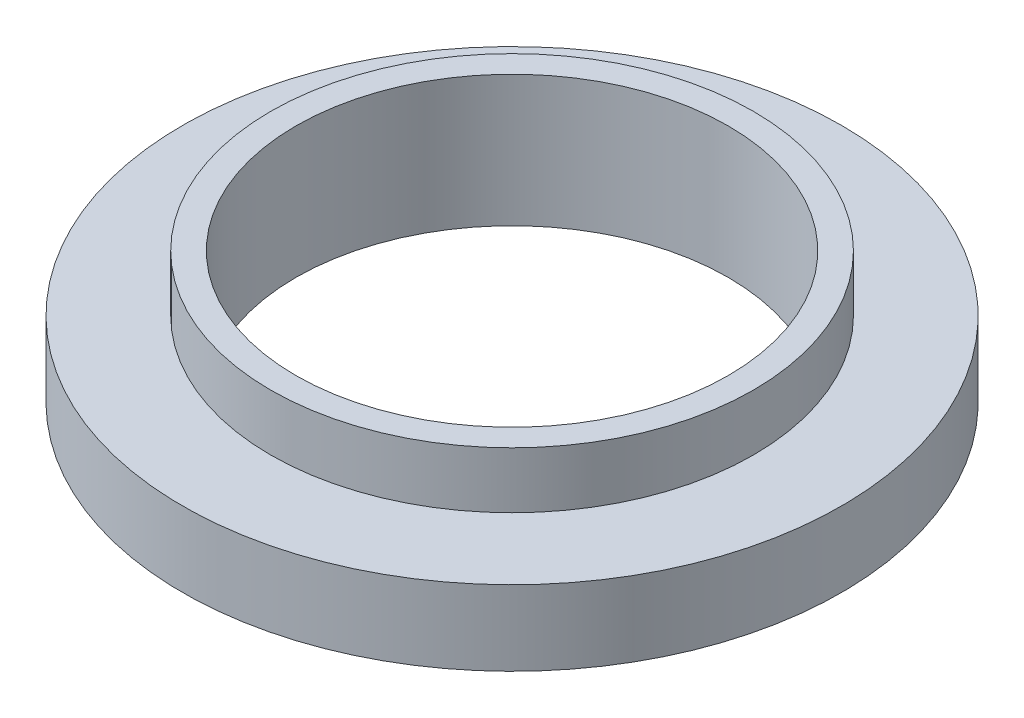
from build123d import *


with BuildPart() as part:
    # Sketch1 → Revolve1 (revolve)
    with BuildSketch(Plane.XY, mode=Mode.PRIVATE) as revolve1_sk:
        Polygon((-31.75, 11.011904892), (-31.75, 30.284206474), (-35.45, 30.284206474), (-35.45, 22.023809654), (-48.4, 22.023809654), (-48.4, 11.011904892), (-37.912336485, 11.011904892), align=None)
    revolve(revolve1_sk.sketch.rotate(Axis((0, 0, 0), (0, 1, 0)), 270), axis=Axis((0, 0, 0), (0, 1, 0)))


solid = part.part
